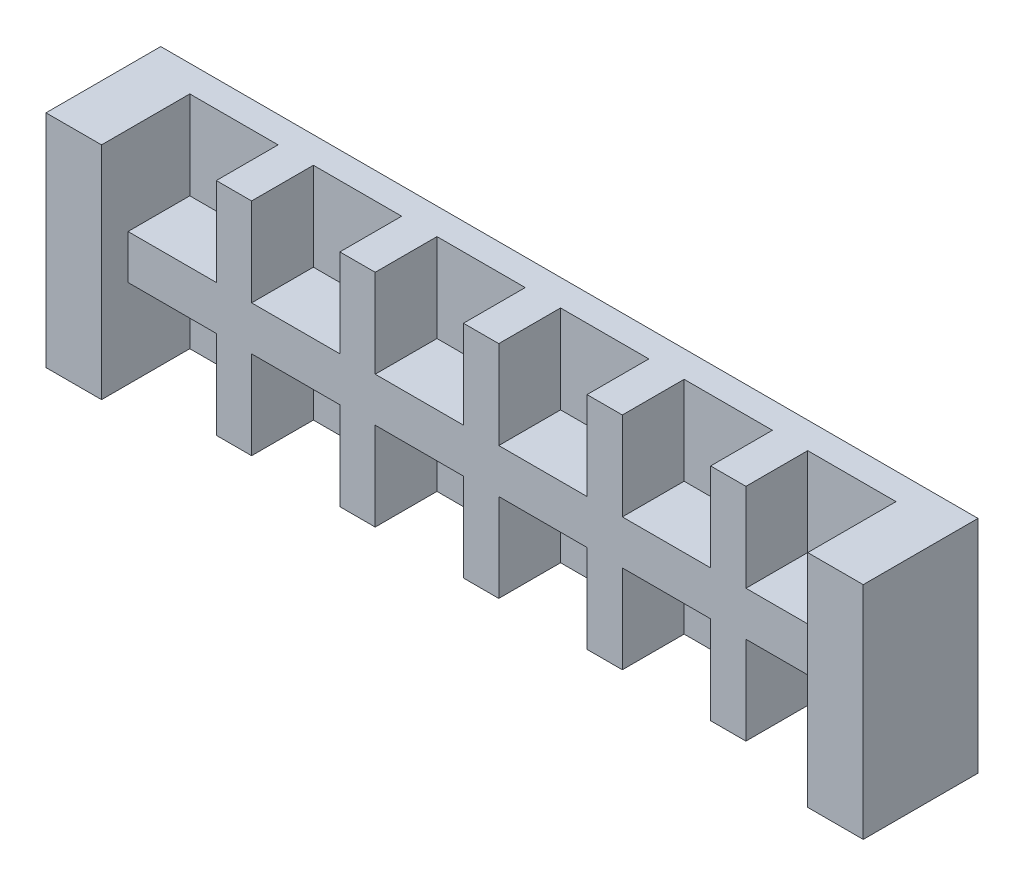
from build123d import *

# Parameters (mm, degrees)
SKETCH1_W           = 80
SKETCH1_H           = 25
BOSS_EXTRUDE1_DEPTH = 10
SKETCH3_2_W         = 10
SKETCH3_2_H         = 10
CUT_EXTRUDE1_DEPTH  = 7
SKETCH3_3_W         = 10
SKETCH3_3_H         = 10
CUT_EXTRUDE2_DEPTH  = 7
SKETCH3_W           = 10
SKETCH3_H           = 10
CUT_EXTRUDE3_DEPTH  = 7
SKETCH3_6_W         = 10
SKETCH3_6_H         = 10
CUT_EXTRUDE4_DEPTH  = 7
SKETCH3_7_W         = 10
SKETCH3_7_H         = 10
CUT_EXTRUDE5_DEPTH  = 7
SKETCH3_8_W         = 10
SKETCH3_8_H         = 10
CUT_EXTRUDE6_DEPTH  = 7
SKETCH3_9_W         = 10
SKETCH3_9_H         = 10
CUT_EXTRUDE7_DEPTH  = 7
SKETCH3_10_W        = 10
SKETCH3_10_H        = 10
CUT_EXTRUDE8_DEPTH  = 7
SKETCH3_11_W        = 10
SKETCH3_11_H        = 10
CUT_EXTRUDE9_DEPTH  = 7
SKETCH3_12_W        = 10
SKETCH3_12_H        = 10
CUT_EXTRUDE10_DEPTH = 7
SKETCH4_W           = 16.29
SKETCH4_H           = 25
BOSS_EXTRUDE2_DEPTH = 10
SKETCH5_W           = 10
SKETCH5_H           = 10
CUT_EXTRUDE12_DEPTH = 7
SKETCH6_W           = 6.292169455
SKETCH6_H           = 25
SKETCH6_W_2         = 6.29
BOSS_EXTRUDE3_DEPTH = 3


with BuildPart() as part:
    # Sketch1 → Boss-Extrude1 (new body)
    with BuildSketch(Plane.XY):
        with Locations((40, -12.5)):
            Rectangle(SKETCH1_W, SKETCH1_H)
    extrude(amount=BOSS_EXTRUDE1_DEPTH)

    # Sketch3<2> → Cut-Extrude1 (cut)
    with BuildSketch(Plane.XY.offset(10)):
        with Locations((11.292169455, -5)):
            Rectangle(SKETCH3_2_W, SKETCH3_2_H)
    extrude(amount=-CUT_EXTRUDE1_DEPTH, mode=Mode.SUBTRACT)

    # Sketch3<3> → Cut-Extrude2 (cut)
    with BuildSketch(Plane.XY.offset(10)):
        with Locations((25.292169455, -5)):
            Rectangle(SKETCH3_3_W, SKETCH3_3_H)
    extrude(amount=-CUT_EXTRUDE2_DEPTH, mode=Mode.SUBTRACT)

    # Sketch3 → Cut-Extrude3 (cut)
    with BuildSketch(Plane.XY.offset(10)):
        with Locations((39.292169455, -5)):
            Rectangle(SKETCH3_W, SKETCH3_H)
    extrude(amount=-CUT_EXTRUDE3_DEPTH, mode=Mode.SUBTRACT)

    # Sketch3<6> → Cut-Extrude4 (cut)
    with BuildSketch(Plane.XY.offset(10)):
        with Locations((53.292169455, -5)):
            Rectangle(SKETCH3_6_W, SKETCH3_6_H)
    extrude(amount=-CUT_EXTRUDE4_DEPTH, mode=Mode.SUBTRACT)

    # Sketch3<7> → Cut-Extrude5 (cut)
    with BuildSketch(Plane.XY.offset(10)):
        with Locations((67.292169455, -5)):
            Rectangle(SKETCH3_7_W, SKETCH3_7_H)
    extrude(amount=-CUT_EXTRUDE5_DEPTH, mode=Mode.SUBTRACT)

    # Sketch3<8> → Cut-Extrude6 (cut)
    with BuildSketch(Plane.XY.offset(10)):
        with Locations((67.292169455, -20)):
            Rectangle(SKETCH3_8_W, SKETCH3_8_H)
    extrude(amount=-CUT_EXTRUDE6_DEPTH, mode=Mode.SUBTRACT)

    # Sketch3<9> → Cut-Extrude7 (cut)
    with BuildSketch(Plane.XY.offset(10)):
        with Locations((53.292169455, -20)):
            Rectangle(SKETCH3_9_W, SKETCH3_9_H)
    extrude(amount=-CUT_EXTRUDE7_DEPTH, mode=Mode.SUBTRACT)

    # Sketch3<10> → Cut-Extrude8 (cut)
    with BuildSketch(Plane.XY.offset(10)):
        with Locations((39.292169455, -20)):
            Rectangle(SKETCH3_10_W, SKETCH3_10_H)
    extrude(amount=-CUT_EXTRUDE8_DEPTH, mode=Mode.SUBTRACT)

    # Sketch3<11> → Cut-Extrude9 (cut)
    with BuildSketch(Plane.XY.offset(10)):
        with Locations((25.292169455, -20)):
            Rectangle(SKETCH3_11_W, SKETCH3_11_H)
    extrude(amount=-CUT_EXTRUDE9_DEPTH, mode=Mode.SUBTRACT)

    # Sketch3<12> → Cut-Extrude10 (cut)
    with BuildSketch(Plane.XY.offset(10)):
        with Locations((11.292169455, -20)):
            Rectangle(SKETCH3_12_W, SKETCH3_12_H)
    extrude(amount=-CUT_EXTRUDE10_DEPTH, mode=Mode.SUBTRACT)

    # Sketch4 → Boss-Extrude2 (add)
    with BuildSketch(Plane.XY.offset(10)):
        with Locations((84.437169455, -12.5)):
            Rectangle(SKETCH4_W, SKETCH4_H)
    extrude(amount=-BOSS_EXTRUDE2_DEPTH)

    # Sketch5 → Cut-Extrude12 (cut)
    with BuildSketch(Plane.XY.offset(10)):
        with Locations((81.292169455, -5)):
            Rectangle(SKETCH5_W, SKETCH5_H)
        with Locations((81.292169455, -20)):
            Rectangle(SKETCH5_W, SKETCH5_H)
    extrude(amount=-CUT_EXTRUDE12_DEPTH, mode=Mode.SUBTRACT)

    # Sketch6 → Boss-Extrude3 (add)
    with BuildSketch(Plane.XY.offset(10)):
        with Locations((3.146084728, -12.5)):
            Rectangle(SKETCH6_W, SKETCH6_H)
        with Locations((89.437169455, -12.5)):
            Rectangle(SKETCH6_W_2, SKETCH6_H)
    extrude(amount=BOSS_EXTRUDE3_DEPTH)


solid = part.part
